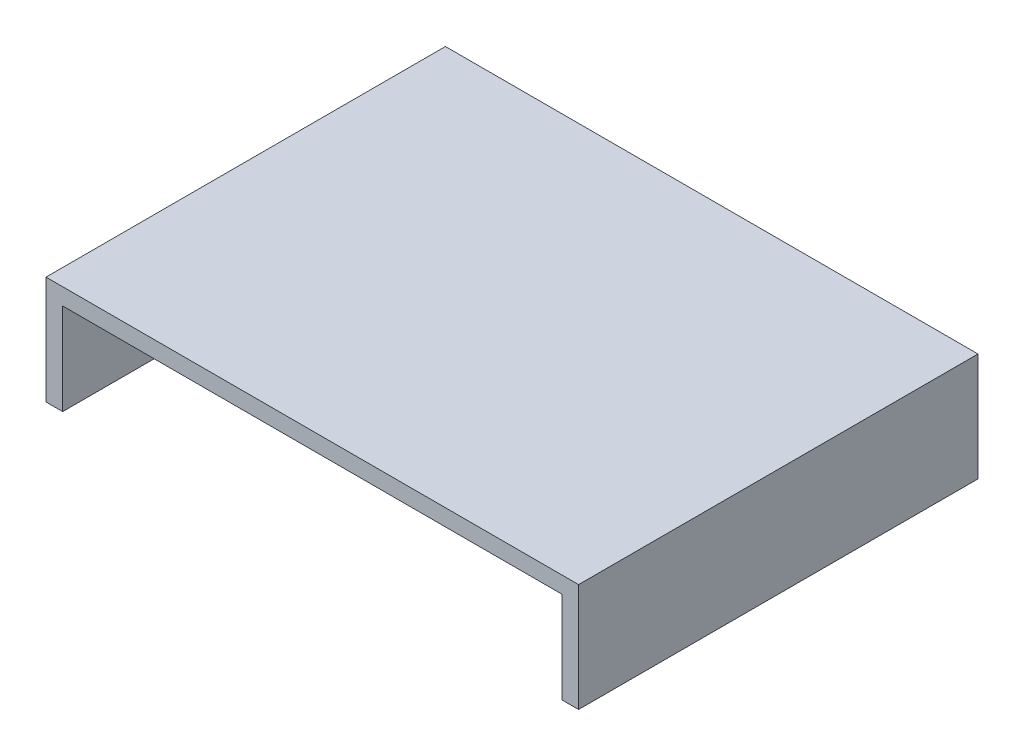
from build123d import *

# Parameters (mm, degrees)
BOSS_EXTRUDE1_DEPTH = 48


with BuildPart() as part:
    # Sketch1 → Boss-Extrude1 (new body)
    with BuildSketch(Plane.XY):
        Polygon((0, 0), (0, 11), (60, 11), (60, 0), (62, 0), (62, 13), (-2, 13), (-2, 0), align=None)
    extrude(amount=BOSS_EXTRUDE1_DEPTH)


solid = part.part
